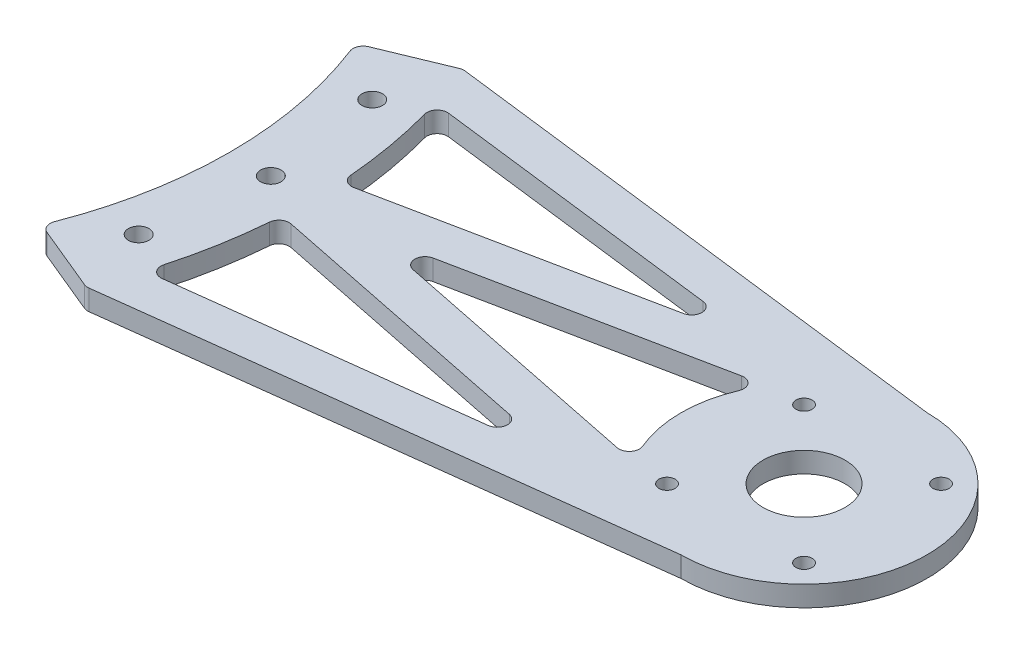
from build123d import *

# Parameters (mm, degrees)
SKETCH2_R           = 1.587499999
SKETCH2_R_2         = 1.25
SKETCH2_R_3         = 1.5875
SKETCH2_R_4         = 6.35
BOSS_EXTRUDE1_DEPTH = 3.175


with BuildPart() as part:
    # Sketch2 → Boss-Extrude1 (new body)
    with BuildSketch(Plane(origin=(0, 0, 0), x_dir=(1, 0, 0), z_dir=(0, 1, 0))):
        with BuildLine():
            Line((0.964859112, -29.109279467), (82.455177287, -19.061691445))
            ThreePointArc((82.455177287, -19.061691445), (82.548309254, -19.052985039), (82.641792328, -19.049778848))
            ThreePointArc((82.641792328, -19.049778848), (101.6, 0), (82.641792328, 19.049778848))
            ThreePointArc((82.641792328, 19.049778848), (82.548309253, 19.052985039), (82.455177286, 19.061691445))
            Line((82.455177286, 19.061691445), (0.964859111, 29.109279468))
            ThreePointArc((0.964859111, 29.109279468), (0.556916612, 29.106764186), (0.163084761, 29.000369251))
            Line((0.163084761, 29.000369251), (-9.734879672, 24.900498144))
            ThreePointArc((-9.734879672, 24.900498144), (-10.586510189, 24.059191564), (-10.608409485, 22.862282328))
            ThreePointArc((-10.608409485, 22.862282328), (-6.35, 0), (-10.608409485, -22.862282328))
            ThreePointArc((-10.608409485, -22.862282328), (-10.586510188, -24.059191565), (-9.734879669, -24.900498144))
            Line((-9.734879669, -24.900498144), (0.163084759, -29.000369251))
            ThreePointArc((0.163084759, -29.000369251), (0.556916612, -29.106764186), (0.964859112, -29.109279467))
        make_face()
        with Locations(Location((-2.380081029, 18.078510302, 0), (0, 0, 270))):
            Circle(SKETCH2_R, mode=Mode.SUBTRACT)
        with Locations(Location((71.943398282, -10.606601718, 0), (0, 0, 270))):
            Circle(SKETCH2_R_2, mode=Mode.SUBTRACT)
        with Locations(Location((93.156601718, 10.606601718, 0), (0, 0, 270))):
            Circle(SKETCH2_R_2, mode=Mode.SUBTRACT)
        with Locations(Location((0, 0, 0), (0, 0, 270))):
            Circle(SKETCH2_R_3, mode=Mode.SUBTRACT)
        with Locations(Location((82.55, 0, 0), (0, 0, 270))):
            Circle(SKETCH2_R_4, mode=Mode.SUBTRACT)
        with Locations(Location((-2.380081039, -18.0785103, 0), (0, 0, 270))):
            Circle(SKETCH2_R_3, mode=Mode.SUBTRACT)
        with Locations(Location((93.156601718, -10.606601718, 0), (0, 0, 270))):
            Circle(SKETCH2_R_2, mode=Mode.SUBTRACT)
        with Locations(Location((71.943398282, 10.606601718, 0), (0, 0, 270))):
            Circle(SKETCH2_R_2, mode=Mode.SUBTRACT)
        with BuildLine():
            Line((50.294045384, 16.629007127), (5.356092049, 22.169764015))
            ThreePointArc((5.356092049, 22.169764015), (3.96079449, 21.632306598), (3.630974021, 20.173905346))
            ThreePointArc((3.630974021, 20.173905346), (5.1822854, 13.288948331), (6.089949704, 6.289995152))
            ThreePointArc((6.089949704, 6.289995152), (6.719257195, 5.151242861), (7.988541906, 4.86540896))
            Line((7.988541906, 4.86540896), (50.416290897, 13.497810396))
            ThreePointArc((50.416290897, 13.497810396), (51.686072517, 15.115368796), (50.294045384, 16.629007127))
        make_face(mode=Mode.SUBTRACT)
        with BuildLine():
            Line((5.356092049, -22.169764016), (50.294045383, -16.629007128))
            ThreePointArc((50.294045383, -16.629007128), (51.686072522, -15.115368797), (50.416290899, -13.497810395))
            Line((50.416290899, -13.497810395), (7.988541905, -4.865408959))
            ThreePointArc((7.988541905, -4.865408959), (6.719257194, -5.151242861), (6.089949704, -6.289995152))
            ThreePointArc((6.089949704, -6.289995152), (5.1822854, -13.288948332), (3.630974021, -20.173905347))
            ThreePointArc((3.630974021, -20.173905347), (3.96079449, -21.6323066), (5.356092049, -22.169764016))
        make_face(mode=Mode.SUBTRACT)
        with BuildLine():
            Line((63.239731304, 9.62678218), (23.57047862, 1.555627757))
            ThreePointArc((23.57047862, 1.555627757), (22.299488539, -1e-09), (23.570478621, -1.555627758))
            Line((23.570478621, -1.555627758), (63.239731303, -9.626782179))
            ThreePointArc((63.239731303, -9.626782179), (64.785781943, -9.075338598), (65.017299588, -7.450296388))
            ThreePointArc((65.017299588, -7.450296388), (63.5, 1e-09), (65.017299589, 7.450296389))
            ThreePointArc((65.017299589, 7.450296389), (64.785781944, 9.075338599), (63.239731304, 9.62678218))
        make_face(mode=Mode.SUBTRACT)
    extrude(amount=BOSS_EXTRUDE1_DEPTH)


solid = part.part
